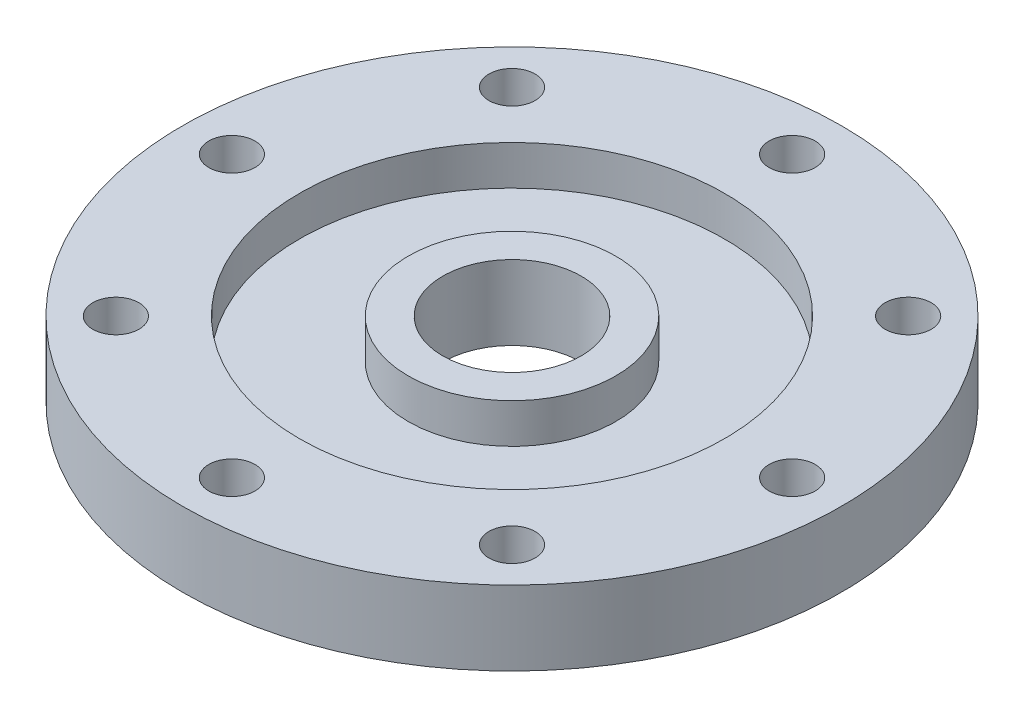
from build123d import *

# Parameters (mm, degrees)
SKETCH2_R           = 25
SKETCH2_R_2         = 5.25
SKETCH2_R_3         = 1.75
BOSS_EXTRUDE1_DEPTH = 2.825
SKETCH3_R           = 16.125
SKETCH3_R_2         = 7.875
CUT_EXTRUDE1_DEPTH  = 3


with BuildPart() as part:
    # Sketch2 → Boss-Extrude1 (new, symmetric)
    with BuildSketch(Plane(origin=(0, 0, 0), x_dir=(1, 0, 0), z_dir=(0, 1, 0))):
        with Locations(Location((0, 0, 0), (0, 0, 270))):
            Circle(SKETCH2_R)
        with Locations(Location((0, 0, 0), (0, 0, 270))):
            Circle(SKETCH2_R_2, mode=Mode.SUBTRACT)
        with Locations(Location((0, 21.25, 0), (0, 0, 270))):
            Circle(SKETCH2_R_3, mode=Mode.SUBTRACT)
        with Locations(Location((15.0260191, 15.0260191, 0), (0, 0, 270))):
            Circle(SKETCH2_R_3, mode=Mode.SUBTRACT)
        with Locations(Location((21.25, 0, 0), (0, 0, 270))):
            Circle(SKETCH2_R_3, mode=Mode.SUBTRACT)
        with Locations(Location((15.0260191, -15.0260191, 0), (0, 0, 270))):
            Circle(SKETCH2_R_3, mode=Mode.SUBTRACT)
        with Locations(Location((0, -21.25, 0), (0, 0, 270))):
            Circle(SKETCH2_R_3, mode=Mode.SUBTRACT)
        with Locations(Location((-15.0260191, -15.0260191, 0), (0, 0, 270))):
            Circle(SKETCH2_R_3, mode=Mode.SUBTRACT)
        with Locations(Location((-21.25, 0, 0), (0, 0, 270))):
            Circle(SKETCH2_R_3, mode=Mode.SUBTRACT)
        with Locations(Location((-15.0260191, 15.0260191, 0), (0, 0, 270))):
            Circle(SKETCH2_R_3, mode=Mode.SUBTRACT)
    extrude(amount=BOSS_EXTRUDE1_DEPTH, both=True)

    # Sketch3 → Cut-Extrude1 (cut)
    with BuildSketch(Plane(origin=(0, 2.825, 0), x_dir=(1, 0, 0), z_dir=(0, 1, 0))):
        with Locations(Location((0, 0, 0), (0, 0, 270))):
            Circle(SKETCH3_R)
        with Locations(Location((0, 0, 0), (0, 0, 270))):
            Circle(SKETCH3_R_2, mode=Mode.SUBTRACT)
    extrude(amount=-CUT_EXTRUDE1_DEPTH, mode=Mode.SUBTRACT)


solid = part.part
